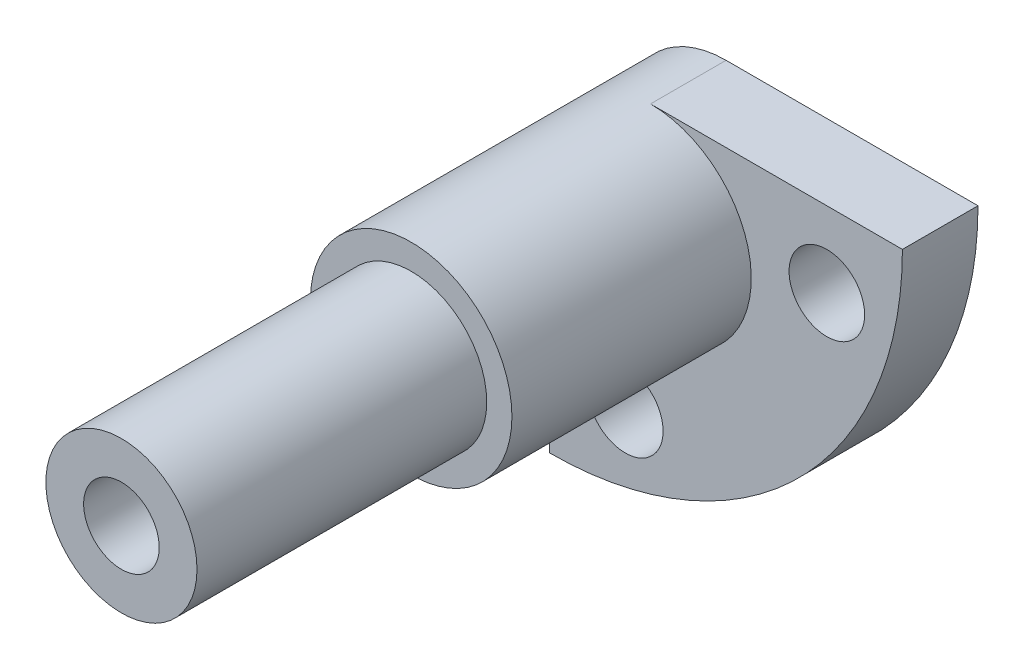
from build123d import *

# Parameters (mm, degrees)
EXTRUDE1_DEPTH = 3
SKETCH2_R      = 4
EXTRUDE2_DEPTH = 9.5
SKETCH3_R      = 3
EXTRUDE3_DEPTH = 11.5
SKETCH4_R      = 1.5
EXTRUDE4_DEPTH = 24
SKETCH5_R      = 1.5
EXTRUDE5_DEPTH = 3


with BuildPart() as part:
    # Sketch1 → Extrude1 (new body)
    with BuildSketch(Plane.XY):
        with BuildLine():
            Line((10, 4), (0, 4))
            ThreePointArc((0, 4), (-2.828427125, 2.828427125), (-4, 0))
            Line((-4, 0), (-4, -10))
            ThreePointArc((-4, -10), (5.899494937, -5.899494937), (10, 4))
        make_face()
    extrude(amount=EXTRUDE1_DEPTH)

    # Sketch2 → Extrude2 (add)
    with BuildSketch(Plane.XY.offset(3)):
        with Locations(Location((0, 0, 0), (0, 0, 180))):
            Circle(SKETCH2_R)
    extrude(amount=EXTRUDE2_DEPTH)

    # Sketch3 → Extrude3 (add)
    with BuildSketch(Plane.XY.offset(12.5)):
        Circle(SKETCH3_R)
    extrude(amount=EXTRUDE3_DEPTH)

    # Sketch4 → Extrude4 (cut)
    with BuildSketch(Plane.XY.offset(24)):
        Circle(SKETCH4_R)
    extrude(amount=-EXTRUDE4_DEPTH, mode=Mode.SUBTRACT)

    # Sketch5 → Extrude5 (cut)
    with BuildSketch(Plane.XY.offset(3)):
        with Locations((7, 1)):
            Circle(SKETCH5_R)
        with Locations((-1, -7)):
            Circle(SKETCH5_R)
    extrude(amount=-EXTRUDE5_DEPTH, mode=Mode.SUBTRACT)


solid = part.part
